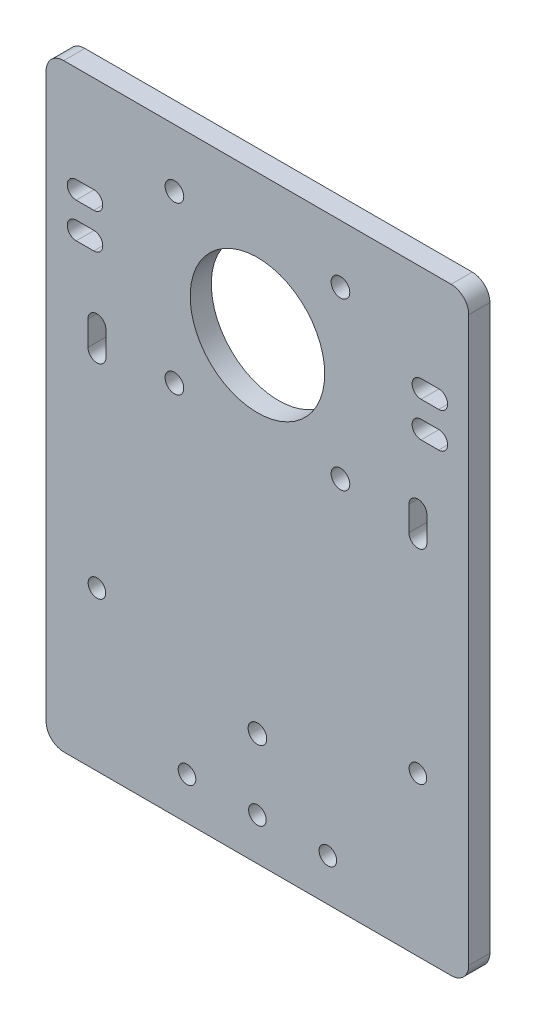
from build123d import *

# Parameters (mm, degrees)
BOSS_EXTRUDE1_DEPTH      = 6
SKETCH3_R                = 19.1
CUT_EXTRUDE1_DEPTH       = 6
M5_CLEARANCE_HOLE1_D     = 5.3
CUT_EXTRUDE2_DEPTH       = 6
CUT_EXTRUDE4_DEPTH       = 6
F_5_0_5_DIAMETER_HOLE4_D = 5
M5_CLEARANCE_HOLE2_D     = 5.3
M5_CLEARANCE_HOLE2_DEPTH = 10
M5_CLEARANCE_HOLE2_TIP   = 1.59228064


with BuildPart() as part:
    # Sketch1 → Boss-Extrude1 (new body)
    with BuildSketch(Plane.XY):
        with BuildLine():
            Line((-55, -85), (55, -85))
            ThreePointArc((55, -85), (58.535533906, -83.535533906), (60, -80))
            Line((60, -80), (60, 80))
            ThreePointArc((60, 80), (58.535533906, 83.535533906), (55, 85))
            Line((55, 85), (-55, 85))
            ThreePointArc((-55, 85), (-58.535533906, 83.535533906), (-60, 80))
            Line((-60, 80), (-60, -80))
            ThreePointArc((-60, -80), (-58.535533906, -83.535533906), (-55, -85))
        make_face()
    extrude(amount=BOSS_EXTRUDE1_DEPTH)

    # Sketch3 → Cut-Extrude1 (cut)
    with BuildSketch(Plane.XY.offset(6)):
        with Locations((0, 45)):
            Circle(SKETCH3_R)
    extrude(amount=-CUT_EXTRUDE1_DEPTH, mode=Mode.SUBTRACT)

    # M5 Clearance Hole1 (through all)
    with Locations(Plane.XY.offset(6)):
        with Locations((-23.57, 68.57), (23.57, 68.57), (23.57, 21.43), (-23.57, 21.43)):
            Hole(M5_CLEARANCE_HOLE1_D / 2)

    # Sketch11 → Cut-Extrude2 (cut)
    with BuildSketch(Plane.XY.offset(6)):
        with BuildLine():
            Line((-43.03, 24.93), (-43.03, 17.93))
            ThreePointArc((-43.03, 17.93), (-45.57, 15.39), (-48.11, 17.93))
            Line((-48.11, 17.93), (-48.11, 24.93))
            ThreePointArc((-48.11, 24.93), (-45.57, 27.47), (-43.03, 24.93))
        make_face()
        with BuildLine():
            Line((43.03, 24.93), (43.03, 17.93))
            ThreePointArc((43.03, 17.93), (45.57, 15.39), (48.11, 17.93))
            Line((48.11, 17.93), (48.11, 24.93))
            ThreePointArc((48.11, 24.93), (45.57, 27.47), (43.03, 24.93))
        make_face()
    extrude(amount=-CUT_EXTRUDE2_DEPTH, mode=Mode.SUBTRACT)

    # Sketch15 → Cut-Extrude4 (cut)
    with BuildSketch(Plane.XY.offset(6)):
        with BuildLine():
            Line((-51.46, 47.54), (-46.46, 47.54))
            ThreePointArc((-46.46, 47.54), (-43.92, 45), (-46.46, 42.46))
            Line((-46.46, 42.46), (-51.46, 42.46))
            ThreePointArc((-51.46, 42.46), (-54, 45), (-51.46, 47.54))
        make_face()
        with BuildLine():
            Line((-51.46, 57.54), (-46.46, 57.54))
            ThreePointArc((-46.46, 57.54), (-43.92, 55), (-46.46, 52.46))
            Line((-46.46, 52.46), (-51.46, 52.46))
            ThreePointArc((-51.46, 52.46), (-54, 55), (-51.46, 57.54))
        make_face()
        with BuildLine():
            Line((51.46, 47.54), (46.46, 47.54))
            ThreePointArc((46.46, 47.54), (43.92, 45), (46.46, 42.46))
            Line((46.46, 42.46), (51.46, 42.46))
            ThreePointArc((51.46, 42.46), (54, 45), (51.46, 47.54))
        make_face()
        with BuildLine():
            Line((51.46, 57.54), (46.46, 57.54))
            ThreePointArc((46.46, 57.54), (43.92, 55), (46.46, 52.46))
            Line((46.46, 52.46), (51.46, 52.46))
            ThreePointArc((51.46, 52.46), (54, 55), (51.46, 57.54))
        make_face()
    extrude(amount=-CUT_EXTRUDE4_DEPTH, mode=Mode.SUBTRACT)

    # Ø5.0 (5) Diameter Hole4 (through all)
    with Locations(Plane.XY.offset(6)):
        with Locations((-45.57, -39.97), (45.57, -39.97), (20, -73), (0, -73), (-20, -73)):
            Hole(F_5_0_5_DIAMETER_HOLE4_D / 2)

    # M5 Clearance Hole2
    with Locations(Plane(origin=(0, 0, 0), x_dir=(-1, 0, 0), z_dir=(0, 0, -1))):
        with Locations((0, -53)):
            Hole(M5_CLEARANCE_HOLE2_D / 2, depth=M5_CLEARANCE_HOLE2_DEPTH)
            with Locations((0, 0, -(M5_CLEARANCE_HOLE2_DEPTH + M5_CLEARANCE_HOLE2_TIP / 2))):  # 118° drill point
                Cone(0, M5_CLEARANCE_HOLE2_D / 2, M5_CLEARANCE_HOLE2_TIP, mode=Mode.SUBTRACT)


solid = part.part
